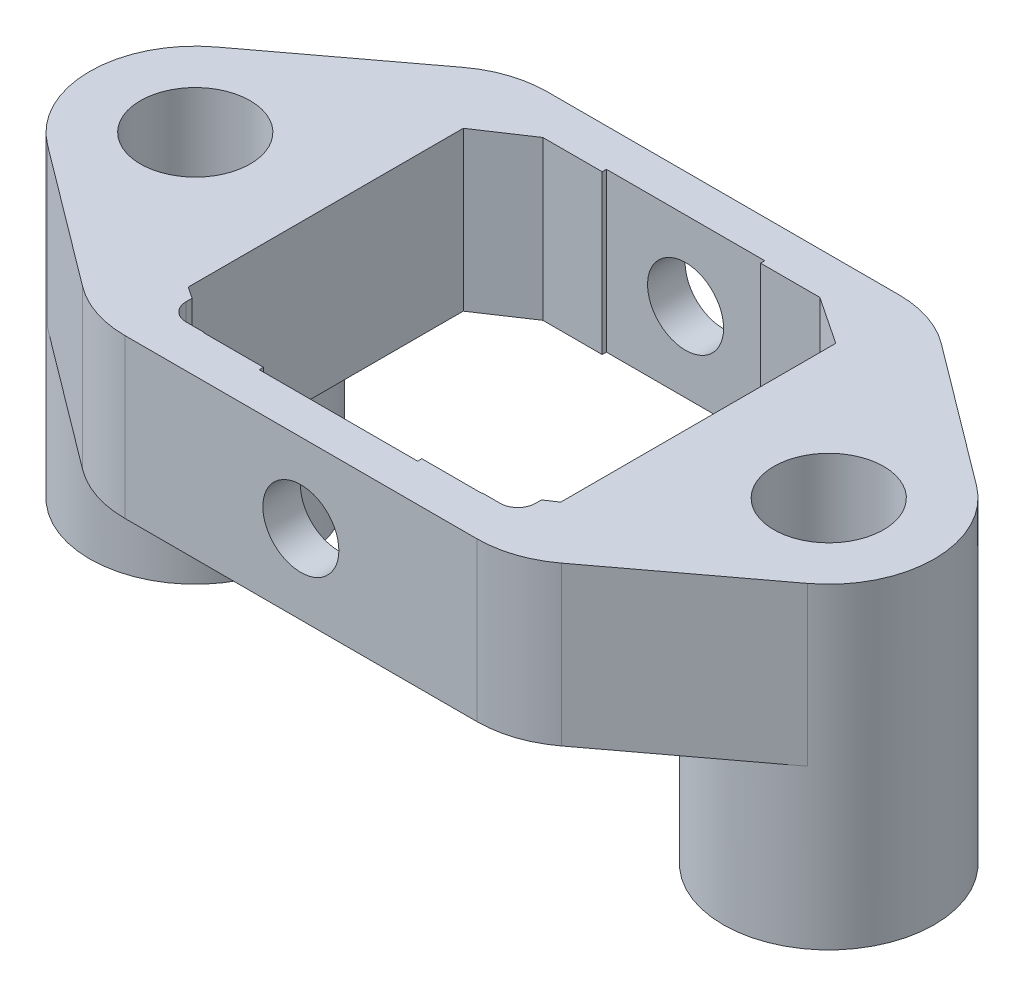
from build123d import *

# Parameters (mm, degrees)
SKETCH1_R           = 3.302
BOSS_EXTRUDE1_DEPTH = 9.525
FILLET1_R           = 6.35
SKETCH2_R           = 2.286
CUT_EXTRUDE1_DEPTH  = 38.162422217
BOSS_EXTRUDE2_START = 9.525
SKETCH3_R           = 6.35
SKETCH3_R_2         = 3.302
BOSS_EXTRUDE2_DEPTH = 9.525


with BuildPart() as part:
    # Sketch1 → Boss-Extrude1 (new body)
    with BuildSketch(Plane(origin=(0, 0, 0), x_dir=(1, 0, 0), z_dir=(0, 1, 0))):
        with BuildLine():
            Line((-12.7, -12.7), (12.7, -12.7))
            Line((12.7, -12.7), (22.86, -5.08))
            ThreePointArc((22.86, -5.08), (25.4, 0), (22.86, 5.08))
            Line((22.86, 5.08), (12.7, 12.7))
            Line((12.7, 12.7), (-12.7, 12.7))
            Line((-12.7, 12.7), (-22.86, 5.08))
            ThreePointArc((-22.86, 5.08), (-25.4, 0), (-22.86, -5.08))
            Line((-22.86, -5.08), (-12.7, -12.7))
        make_face()
        with Locations(Location((-19.05, 0, 0), (0, 0, 90))):
            Circle(SKETCH1_R, mode=Mode.SUBTRACT)
        with Locations(Location((19.05, 0, 0), (0, 0, 90))):
            Circle(SKETCH1_R, mode=Mode.SUBTRACT)
        with BuildLine():
            Line((4.7625, -10.1854), (8.329805012, -10.1854))
            Line((8.329805012, -10.1854), (8.376905012, -10.154))
            Line((8.376905012, -10.154), (9.416515139, -10.154))
            ThreePointArc((9.416515139, -10.154), (9.501675056, -10.1507417), (9.586332782, -10.140948982))
            Line((9.586332782, -10.140948982), (9.615351798, -10.140948982))
            ThreePointArc((9.615351798, -10.140948982), (10.251622353, -9.784337345), (10.504, -9.1))
            Line((10.504, -9.1), (10.504, -8.735936675))
            Line((10.504, -8.735936675), (11.2014, -8.271003341))
            Line((11.2014, -8.271003341), (11.2014, 8.271003341))
            Line((11.2014, 8.271003341), (8.329805012, 10.1854))
            Line((8.329805012, 10.1854), (4.7625, 10.1854))
            Line((4.7625, 10.1854), (4.7625, 10.4394))
            Line((4.7625, 10.4394), (-4.7625, 10.4394))
            Line((-4.7625, 10.4394), (-4.7625, 10.1854))
            Line((-4.7625, 10.1854), (-8.329805012, 10.1854))
            Line((-8.329805012, 10.1854), (-11.2014, 8.271003341))
            Line((-11.2014, 8.271003341), (-11.2014, -8.271003341))
            Line((-11.2014, -8.271003341), (-10.504, -8.735936675))
            Line((-10.504, -8.735936675), (-10.504, -9.1))
            ThreePointArc((-10.504, -9.1), (-10.251622353, -9.784337345), (-9.615351798, -10.140948982))
            Line((-9.615351798, -10.140948982), (-9.586332782, -10.140948982))
            ThreePointArc((-9.586332782, -10.140948982), (-9.501675056, -10.1507417), (-9.416515139, -10.154))
            Line((-9.416515139, -10.154), (-8.376905012, -10.154))
            Line((-8.376905012, -10.154), (-8.329805012, -10.1854))
            Line((-8.329805012, -10.1854), (-4.7625, -10.1854))
            Line((-4.7625, -10.1854), (-4.7625, -10.4394))
            Line((-4.7625, -10.4394), (4.7625, -10.4394))
            Line((4.7625, -10.4394), (4.7625, -10.1854))
        make_face(mode=Mode.SUBTRACT)
    extrude(amount=BOSS_EXTRUDE1_DEPTH)

    # Fillet1
    fillet1_edges = [part.edges().sort_by_distance(p)[0] for p in [
        (12.7, 4.7625, -12.7),
        (12.7, 4.7625, 12.7),
        (-12.7, 4.7625, 12.7),
        (-12.7, 4.7625, -12.7),
    ]]
    fillet(fillet1_edges, radius=FILLET1_R)

    # Sketch2 → Cut-Extrude1 (cut, through all)
    with BuildSketch(Plane.XY.offset(12.7)):
        with Locations((0, 4.7625)):
            Circle(SKETCH2_R)
    extrude(amount=-CUT_EXTRUDE1_DEPTH, mode=Mode.SUBTRACT)

    # Sketch3 → Boss-Extrude2 (add)
    # profile 1 of 2: a face of its own
    with BuildSketch(Plane(origin=(0, 0, 0), x_dir=(-1, 0, 0), z_dir=(0, -1, 0)).offset(BOSS_EXTRUDE2_START)):
        with Locations(Location((19.05, 0, 0), (0, 0, 90))):
            Circle(SKETCH3_R)
        with Locations(Location((19.05, 0, 0), (0, 0, 90))):
            Circle(SKETCH3_R_2, mode=Mode.SUBTRACT)
    # profile 2 of 2: a face of its own
    with BuildSketch(Plane(origin=(0, 0, 0), x_dir=(-1, 0, 0), z_dir=(0, -1, 0)).offset(BOSS_EXTRUDE2_START)):
        with Locations(Location((-19.05, 0, 0), (0, 0, 90))):
            Circle(SKETCH3_R)
        with Locations(Location((-19.05, 0, 0), (0, 0, 90))):
            Circle(SKETCH3_R_2, mode=Mode.SUBTRACT)
    extrude(amount=-BOSS_EXTRUDE2_DEPTH)


solid = part.part
